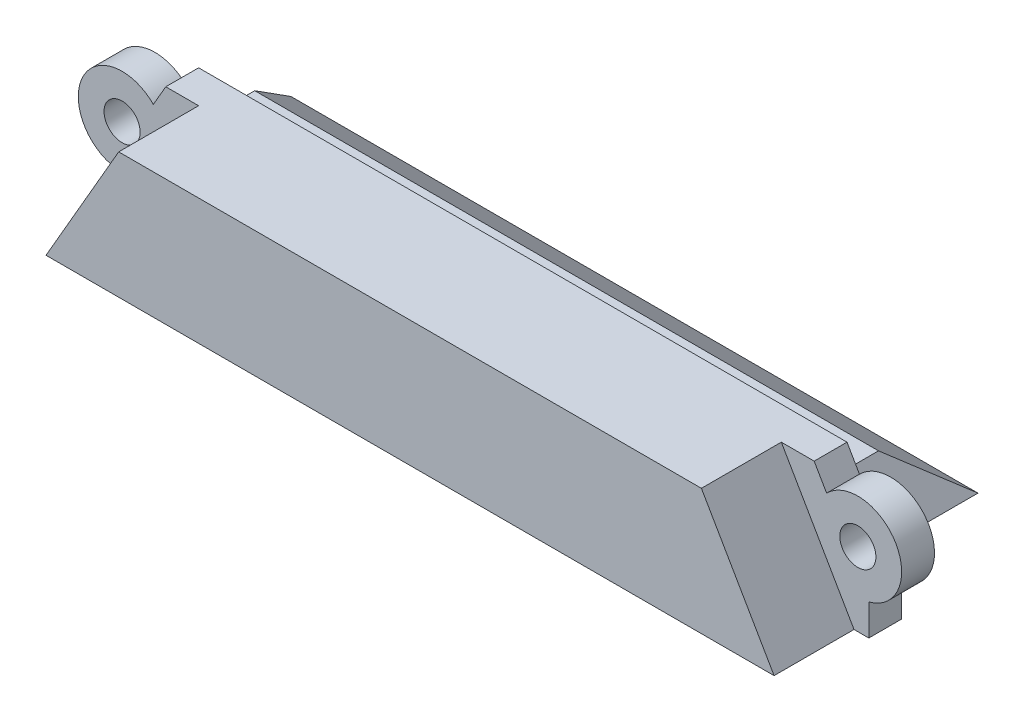
from build123d import *

# Parameters (mm, degrees)
BOSS_EXTRUDE1_DEPTH     = 10.3
BOSS_EXTRUDE2_DEPTH     = 20.5
CUT_EXTRUDE1_DEPTH      = 40.4825911
CUT_EXTRUDE1_DEPTH_BACK = 40.4825911
SKETCH3_R               = 1.65
BOSS_EXTRUDE3_DEPTH     = 3


with BuildPart() as part:
    # Sketch1 → Boss-Extrude1 (new body)
    with BuildSketch(Plane.XY):
        Polygon((-33.25, -5.75), (33.25, -5.75), (26.610471904, 5.75), (-26.610471904, 5.75), align=None)
    extrude(amount=-BOSS_EXTRUDE1_DEPTH)

    # Sketch1<5> → Boss-Extrude2 (add)
    with BuildSketch(Plane.XY):
        Polygon((-28.486860279, 2.5), (-31.373611625, -2.5), (31.373611625, -2.5), (28.486860279, 2.5), align=None)
    extrude(amount=-BOSS_EXTRUDE2_DEPTH)

    # Sketch2 → Cut-Extrude1 (cut, two sides: drawn at the far end of the back side and taken through both)
    with BuildSketch(Plane(origin=(0, 0, 0), x_dir=(0, 0, -1), z_dir=(1, 0, 0)).offset(-CUT_EXTRUDE1_DEPTH_BACK)):
        Polygon((20.5, -2.5), (14.3, 2.5), (20.5, 2.5), align=None)
    extrude(amount=CUT_EXTRUDE1_DEPTH + CUT_EXTRUDE1_DEPTH_BACK, mode=Mode.SUBTRACT)

    # Sketch3 → Boss-Extrude3 (add)
    with BuildSketch(Plane(origin=(0, 0, -10.3), x_dir=(-1, 0, 0), z_dir=(0, 0, -1))):
        with BuildLine():
            Line((-33.25, -5.75), (-34.6, -5.75))
            Line((-34.6, -5.75), (-34.6, -2.892116168))
            ThreePointArc((-34.6, -2.892116168), (-37.064101615, 2.980867179), (-30.745898034, 3.783384256))
            Line((-30.745898034, 3.783384256), (-29.610471904, 5.75))
            Line((-29.610471904, 5.75), (-26.610471904, 5.75))
            Line((-26.610471904, 5.75), (-33.25, -5.75))
        make_face()
        with Locations((-33.6, 0.980867179)):
            Circle(SKETCH3_R, mode=Mode.SUBTRACT)
    boss_extrude3 = extrude(amount=-BOSS_EXTRUDE3_DEPTH)

    # Mirror1: Boss-Extrude3 across plane
    add(boss_extrude3.mirror(Plane(origin=(0, 0, 0), x_dir=(0, 0, 1), z_dir=(1, 0, 0))))


solid = part.part
